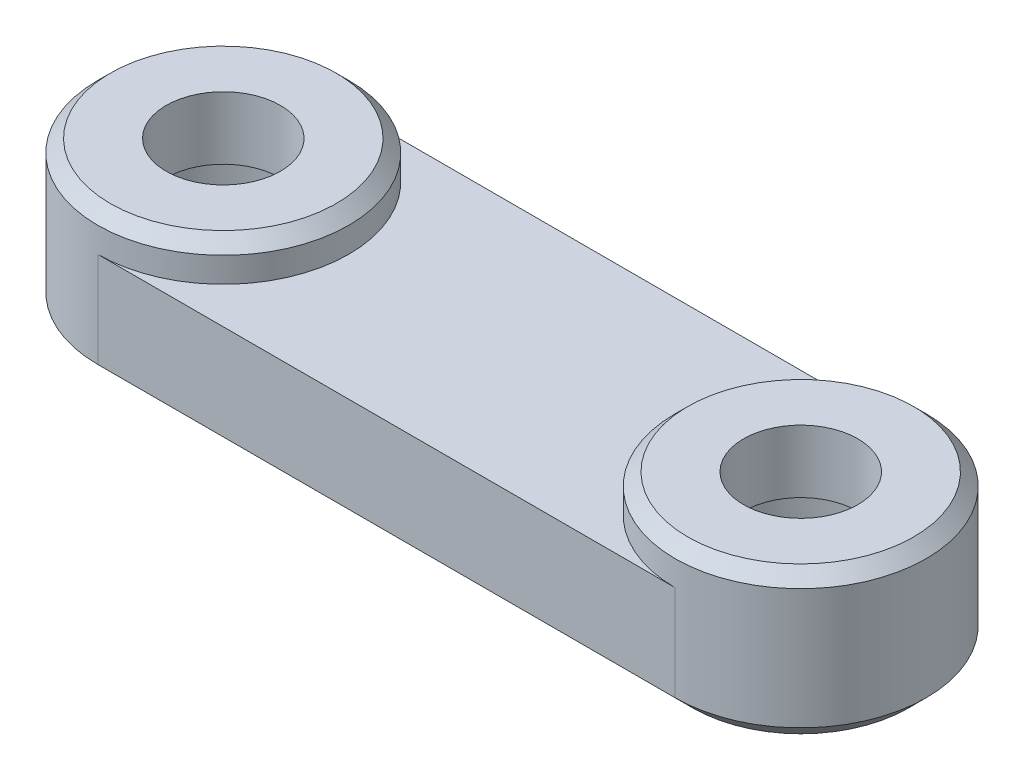
from build123d import *

# Parameters (mm, degrees)
EXTRUDE_1_DEPTH     = 6
CUT_EXTRUDE_START   = -1.5
SKETCH_4_W          = 74.791186833
SKETCH_4_H          = 47.147225829
SKETCH_4_R          = 5
CUT_EXTRUDE_1_DEPTH = 1.5
CHAMFER_1_SIZE      = 0.5
CHAMFER_2_SIZE      = 0.7


with BuildPart() as part:
    # 草图1 → 凸台-拉伸1 (new body)
    with BuildSketch(Plane(origin=(0, 0, 0), x_dir=(1, 0, 0), z_dir=(0, 1, 0))):
        with BuildLine():
            Line((0, 5), (23, 5))
            ThreePointArc((23, 5), (28, 0), (23, -5))
            Line((23, -5), (0, -5))
            ThreePointArc((0, -5), (-5, 0), (0, 5))
        make_face()
    extrude(amount=EXTRUDE_1_DEPTH)

    # 草图2 → 切除-旋转1 (revolve, cut)
    with BuildSketch(Plane.XY, mode=Mode.PRIVATE) as cut_revolve_1_sk:
        Polygon((-4, 0), (-4, 3.5), (-2.275, 3.5), (-2.275, 6), (0, 6), (0, 0), align=None)
    revolve(cut_revolve_1_sk.sketch.rotate(Axis((0, 0, 0), (0, 1, 0)), 270), axis=Axis((0, 0, 0), (0, 1, 0)), mode=Mode.SUBTRACT)

    # 草图3 → 切除-旋转2 (revolve, cut)
    with BuildSketch(Plane.XY, mode=Mode.PRIVATE) as cut_revolve_2_sk:
        Polygon((23, 0), (19, 0), (19, 3.5), (20.725, 3.5), (20.725, 6), (23, 6), align=None)
    revolve(cut_revolve_2_sk.sketch.rotate(Axis((23, 0, 0), (0, 1, 0)), 270), axis=Axis((23, 0, 0), (0, 1, 0)), mode=Mode.SUBTRACT)

    # 草图4 → 切除-拉伸1 (cut)
    with BuildSketch(Plane(origin=(0, 6, 0), x_dir=(1, 0, 0), z_dir=(0, 1, 0)).offset(CUT_EXTRUDE_START)):
        with Locations((14.679246855, 1.415799858)):
            Rectangle(SKETCH_4_W, SKETCH_4_H)
        with Locations(Location((23, 0, 0), (0, 0, 270))):
            Circle(SKETCH_4_R, mode=Mode.SUBTRACT)
        with Locations(Location((0, 0, 0), (0, 0, 270))):
            Circle(SKETCH_4_R, mode=Mode.SUBTRACT)
    extrude(amount=CUT_EXTRUDE_1_DEPTH, mode=Mode.SUBTRACT)

    # 倒角1
    chamfer_1_edges = [part.edges().sort_by_distance(p)[0] for p in [
        (23, 6, 5),
        (0, 6, -5),
    ]]
    chamfer(chamfer_1_edges, length=CHAMFER_1_SIZE)

    # 倒角2
    chamfer_2_edges = [part.edges().sort_by_distance(p)[0] for p in [
        (11.5, 0, -5),
        (28, 0, 0),
        (11.5, 0, 5),
        (-5, 0, 0),
    ]]
    chamfer(chamfer_2_edges, length=CHAMFER_2_SIZE)


solid = part.part
